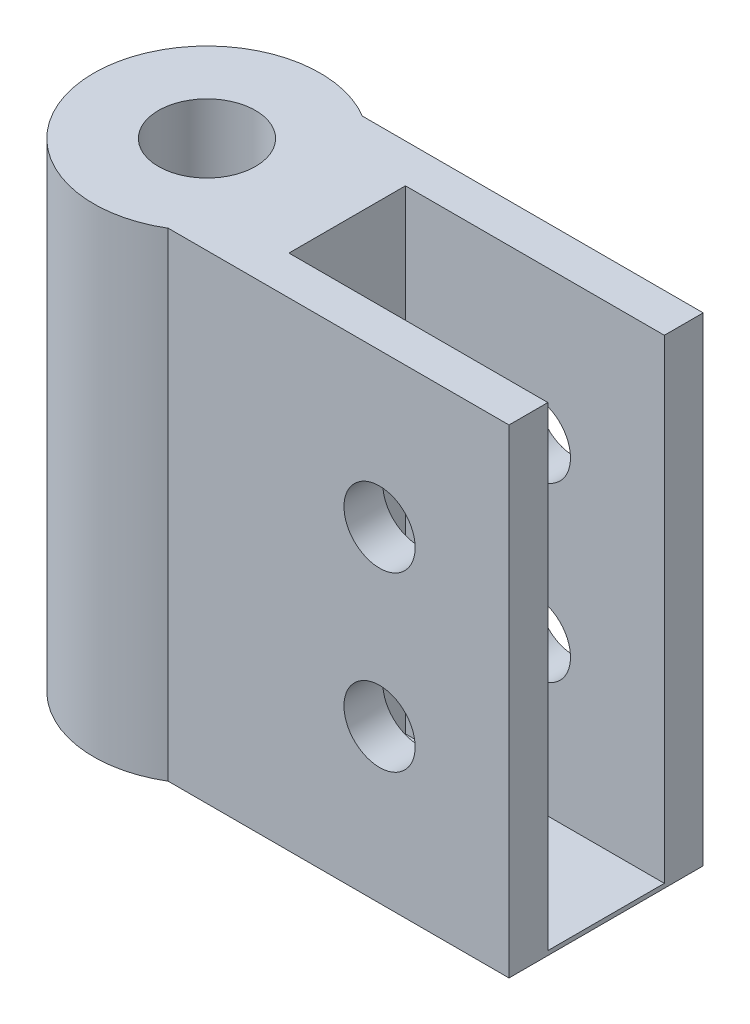
from build123d import *

# Parameters (mm, degrees)
SKETCH_1_R          = 5.25
SKETCH_1_R_2        = 2.25
EXTRUDE_1_DEPTH     = 22.2
SKETCH_2_W          = 16
SKETCH_2_H          = 9
EXTRUDE_2_DEPTH     = 22.2
SKETCH_3_W          = 12
SKETCH_3_H          = 5.4
CUT_EXTRUDE_1_DEPTH = 22
SKETCH_4_R          = 1.65
CUT_EXTRUDE_2_DEPTH = 22


with BuildPart() as part:
    # 草图1 → 凸台-拉伸1 (new body)
    with BuildSketch(Plane(origin=(0, 0, 0), x_dir=(1, 0, 0), z_dir=(0, 1, 0))):
        with Locations(Location((0, 0, 0), (0, 0, 270))):
            Circle(SKETCH_1_R)
        with Locations(Location((0, 0, 0), (0, 0, 270))):
            Circle(SKETCH_1_R_2, mode=Mode.SUBTRACT)
    extrude(amount=EXTRUDE_1_DEPTH)

    # 草图2 → 凸台-拉伸2 (add)
    with BuildSketch(Plane(origin=(0, 22.2, 0), x_dir=(1, 0, 0), z_dir=(0, 1, 0))):
        with Locations((10.5, 0)):
            Rectangle(SKETCH_2_W, SKETCH_2_H)
    extrude(amount=-EXTRUDE_2_DEPTH)

    # 草图3 → 切除-拉伸1 (cut)
    with BuildSketch(Plane(origin=(0, 22.2, 0), x_dir=(1, 0, 0), z_dir=(0, 1, 0))):
        with Locations((12.5, 0)):
            Rectangle(SKETCH_3_W, SKETCH_3_H)
    extrude(amount=-CUT_EXTRUDE_1_DEPTH, mode=Mode.SUBTRACT)

    # 草图4 → 切除-拉伸2 (cut)
    with BuildSketch(Plane.XY.offset(4.5)):
        with Locations(Location((12.5, 15.1, 0), (0, 0, 180))):
            Circle(SKETCH_4_R)
        with Locations(Location((12.5, 7.1, 0), (0, 0, 180))):
            Circle(SKETCH_4_R)
    extrude(amount=-CUT_EXTRUDE_2_DEPTH, mode=Mode.SUBTRACT)


solid = part.part
